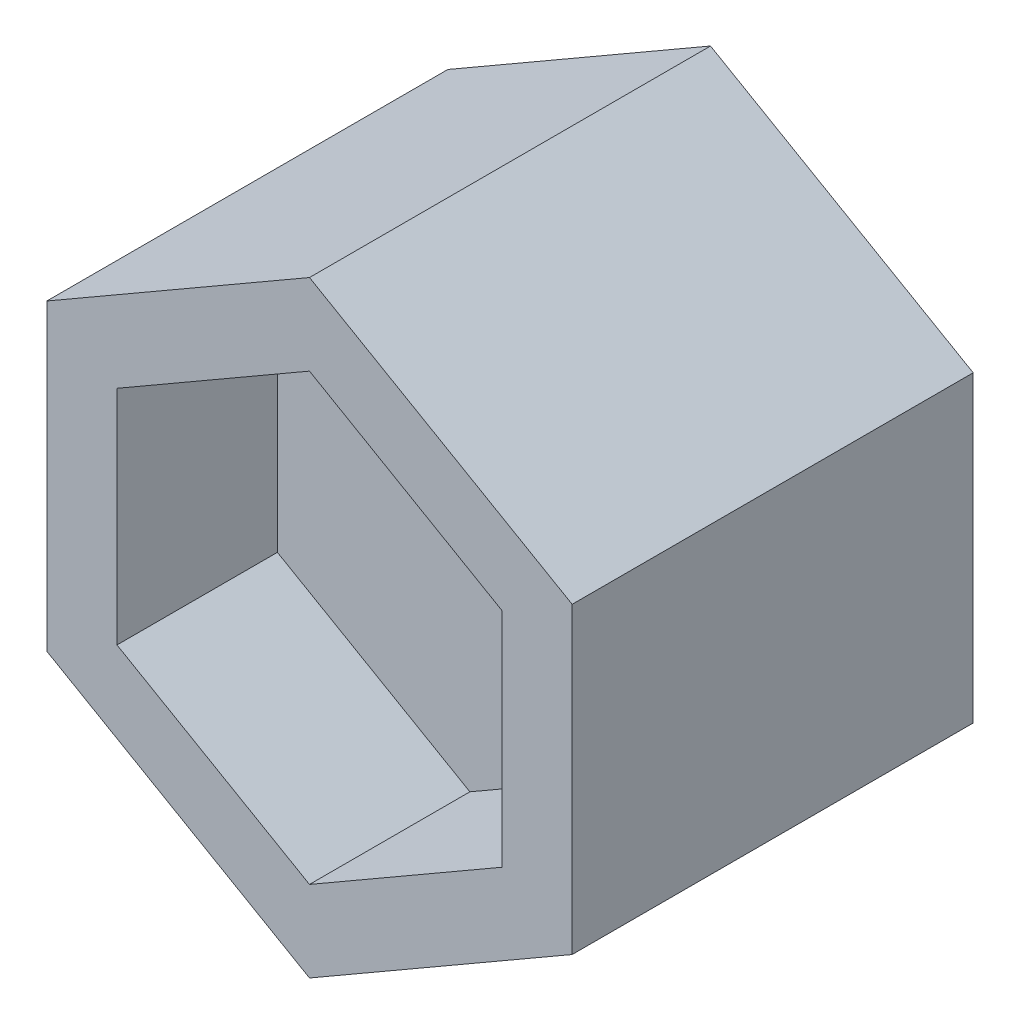
from build123d import *

# Parameters (mm, degrees)
BOSS_EXTRUDE1_DEPTH      = 10
BOSS_EXTRUDE1_DEPTH_BACK = 10
BOSS_EXTRUDE2_DEPTH      = 2
BOSS_EXTRUDE2_DEPTH_BACK = 2


with BuildPart() as part:
    # Sketch1 → Boss-Extrude1 (new, two sides: drawn at the far end of the back side and taken through both)
    with BuildSketch(Plane(origin=(0, 0, 0), x_dir=(0, 1, 0), z_dir=(0, 0, 1)).offset(-BOSS_EXTRUDE1_DEPTH_BACK)):
        Polygon((7.563288526, 13.1), (-7.563288526, 13.1), (-15.126577053, 0), (-7.563288526, -13.1), (7.563288526, -13.1), (15.126577053, 0), align=None)
        Polygon((5.542562584, 9.6), (-5.542562584, 9.6), (-11.085125168, 0), (-5.542562584, -9.6), (5.542562584, -9.6), (11.085125168, 0), align=None, mode=Mode.SUBTRACT)
    extrude(amount=BOSS_EXTRUDE1_DEPTH + BOSS_EXTRUDE1_DEPTH_BACK)

    # Sketch2 → Boss-Extrude2 (add, two sides: drawn at the far end of the back side and taken through both)
    with BuildSketch(Plane(origin=(0, 0, 0), x_dir=(0, 1, 0), z_dir=(0, 0, 1)).offset(-BOSS_EXTRUDE2_DEPTH_BACK)):
        Polygon((15.126577053, 0), (7.563288526, 13.1), (-7.563288526, 13.1), (-15.126577053, 0), (-7.563288526, -13.1), (7.563288526, -13.1), align=None)
    extrude(amount=BOSS_EXTRUDE2_DEPTH + BOSS_EXTRUDE2_DEPTH_BACK)


solid = part.part
